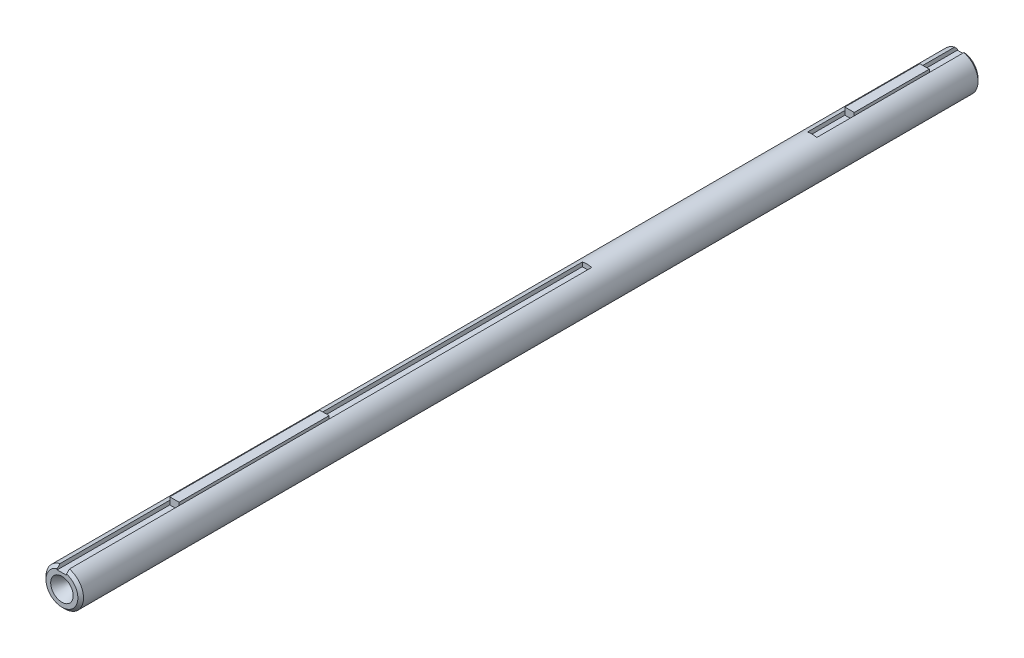
from build123d import *

# Parameters (mm, degrees)
SKETCH1_R           = 12.7
EXTRUDE1_DEPTH      = 304.8
CHAMFER1_SIZE       = 1.905
EXTRUDE2_DEPTH      = 306.328708116
EXTRUDE2_DEPTH_BACK = 306.328708116
SKETCH3_W           = 6.35
SKETCH3_H           = 3.175
EXTRUDE3_START      = -203.2
SKETCH1_2_R         = 12.7
EXTRUDE3_DEPTH      = 152.4
SKETCH5_W           = 6.35
SKETCH5_H           = 4.7625
EXTRUDE4_DEPTH      = 101.6
SKETCH6_W           = 6.35
SKETCH6_H           = 4.7625
EXTRUDE5_DEPTH      = 25.4


with BuildPart() as part:
    # Sketch1 → Extrude1 (new, symmetric)
    with BuildSketch(Plane.XY):
        with Locations(Location((0, 0, 0), (0, 0, 180))):
            Circle(SKETCH1_R)
    extrude(amount=EXTRUDE1_DEPTH, both=True)

    # Chamfer1
    chamfer1_edges = [part.edges().sort_by_distance(p)[0] for p in [
        (12.7, 0, -304.8),
        (12.7, 0, 304.8),
    ]]
    chamfer(chamfer1_edges, length=CHAMFER1_SIZE)

    # Sketch3 → Extrude2 (cut, two sides: drawn at the far end of the back side and taken through both)
    with BuildSketch(Plane.XY.offset(-EXTRUDE2_DEPTH_BACK)):
        with Locations((0, 11.1125)):
            Rectangle(SKETCH3_W, SKETCH3_H)
    extrude(amount=EXTRUDE2_DEPTH + EXTRUDE2_DEPTH_BACK, mode=Mode.SUBTRACT)

    # Sketch1<2> → Extrude3 (add)
    with BuildSketch(Plane.XY.offset(EXTRUDE3_START)):
        with Locations(Location((0, 0, 0), (0, 0, 104.477512186))):
            Circle(SKETCH1_2_R)
    extrude(amount=EXTRUDE3_DEPTH)

    # Sketch8 → Cut-Revolve1 (revolve, cut)
    with BuildSketch(Plane(origin=(0, 0, 0), x_dir=(0, 0, -1), z_dir=(1, 0, 0))):
        Polygon((-304.8, -0.238735613), (-288.878930704, -0.238735613), (-290.75103416, 2.936264387), (-297.10103416, 2.936264387), (-304.8, 7.381264387), (-309.984886671, 7.381264387), (-309.984886671, -0.238735613), align=None)
    cut_revolve1 = revolve(axis=Axis((0, -0.238735613, -304.8), (0, 0, 1)), mode=Mode.SUBTRACT)

    # Mirror1: Cut-Revolve1 across plane
    add(cut_revolve1.mirror(Plane.XY), mode=Mode.SUBTRACT)


with BuildPart() as body_2:
    # Sketch5 → Extrude4 (new body)
    with BuildSketch(Plane.XY.offset(228.6)):
        with Locations((0, 11.90625)):
            Rectangle(SKETCH5_W, SKETCH5_H)
    extrude(amount=-EXTRUDE4_DEPTH)


with BuildPart() as body_3:
    # Sketch6 → Extrude5 (new, symmetric)
    with BuildSketch(Plane(origin=(0, 0, -254), x_dir=(-1, 0, 0), z_dir=(0, 0, -1))):
        with Locations((0, 11.90625)):
            Rectangle(SKETCH6_W, SKETCH6_H)
    extrude(amount=EXTRUDE5_DEPTH, both=True)


solid = Compound([part.part, body_2.part, body_3.part])
